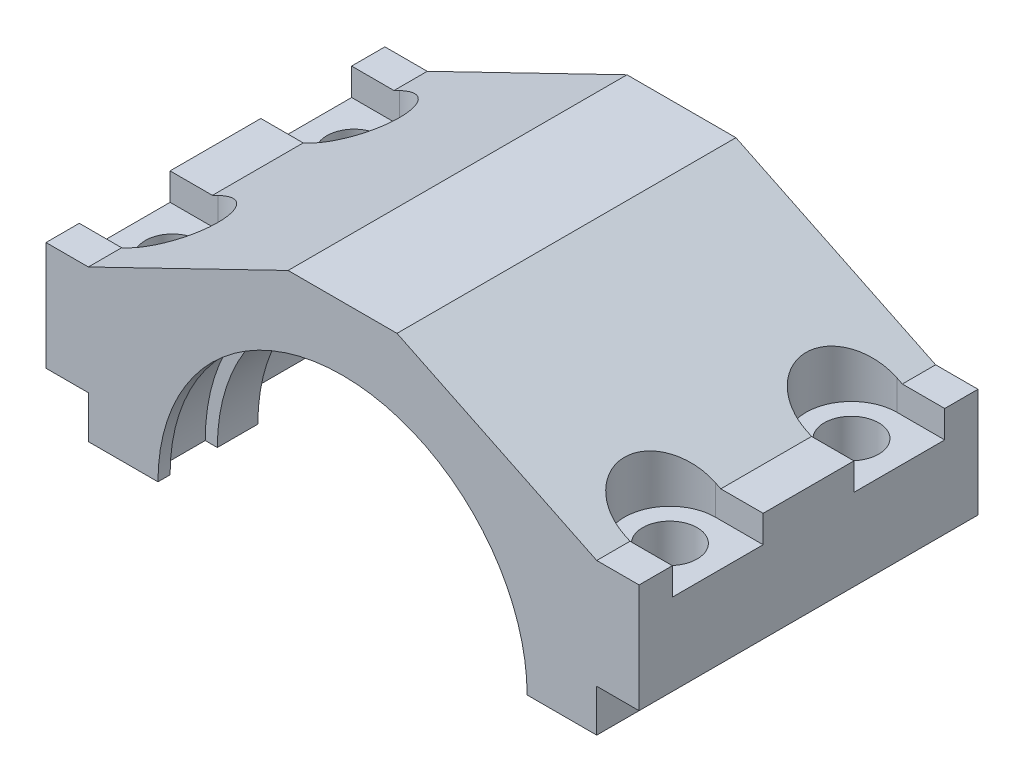
from build123d import *

# Parameters (mm, degrees)
BOSS_EXTRUDE1_DEPTH     = 28
CUT_EXTRUDE1_DEPTH      = 85.958813551
CUT_EXTRUDE2_DEPTH      = 70.756720106
CUT_EXTRUDE2_DEPTH_BACK = 4.5
CUT_EXTRUDE2_START      = 25
CUT_EXTRUDE3_START      = 25
SKETCH4_4_R             = 4.5
CUT_EXTRUDE3_DEPTH      = 95.756720106


with BuildPart() as part:
    # Sketch1 → Boss-Extrude1 (new, symmetric)
    with BuildSketch(Plane.XY):
        Polygon((-42, 0), (42, 0), (42, 7), (49, 7), (49, 25), (42, 25), (9, 41), (-9, 41), (-42, 25), (-49, 25), (-49, 7), (-42, 7), align=None)
    extrude(amount=BOSS_EXTRUDE1_DEPTH, both=True)

    # Sketch2 → Cut-Extrude1 (cut, through all)
    with BuildSketch(Plane.XY.offset(28)):
        with BuildLine():
            Line((-30.5, 0), (30.5, 0))
            ThreePointArc((30.5, 0), (0, 30.5), (-30.5, 0))
        make_face()
    extrude(amount=-CUT_EXTRUDE1_DEPTH, mode=Mode.SUBTRACT)

    # Sketch3 → Cut-Revolve1 (revolve, cut)
    with BuildSketch(Plane(origin=(0, 0, 0), x_dir=(0, 0, -1), z_dir=(1, 0, 0))):
        Polygon((28, 30.5), (26, 30.5), (26, 32.5), (17, 32.5), (17, 29.816601461), (11.5, 29.816601461), (11.5, 36), (-11.5, 36), (-11.5, 29.816601461), (-18.19, 29.816601461), (-18.19, 32.5), (-26, 32.5), (-26, 30.5), (-28, 30.5), (-28, 0), (28, 0), align=None)
    revolve(axis=Axis((0, 0, 28), (0, 0, -1)), mode=Mode.SUBTRACT)

    # Sketch4 → Cut-Extrude2 (cut, two sides: drawn at the far end of the back side and taken through both)
    with BuildSketch(Plane(origin=(0, 0, 0), x_dir=(1, 0, 0), z_dir=(0, 1, 0)).offset(CUT_EXTRUDE2_START - CUT_EXTRUDE2_DEPTH_BACK)):
        with BuildLine():
            Line((49, 22.5), (41.09, 22.5))
            ThreePointArc((41.09, 22.5), (33.59, 15), (41.09, 7.5))
            Line((41.09, 7.5), (49, 7.5))
            Line((49, 7.5), (49, 22.5))
        make_face()
        with BuildLine():
            Line((49, -7.5), (49, -22.5))
            Line((49, -22.5), (41.09, -22.5))
            ThreePointArc((41.09, -22.5), (33.59, -15), (41.09, -7.5))
            Line((41.09, -7.5), (49, -7.5))
        make_face()
        with BuildLine():
            Line((-49, -22.5), (-41.09, -22.5))
            ThreePointArc((-41.09, -22.5), (-33.59, -15), (-41.09, -7.5))
            Line((-41.09, -7.5), (-49, -7.5))
            Line((-49, -7.5), (-49, -22.5))
        make_face()
        with BuildLine():
            Line((-49, 7.5), (-49, 22.5))
            Line((-49, 22.5), (-41.09, 22.5))
            ThreePointArc((-41.09, 22.5), (-33.59, 15), (-41.09, 7.5))
            Line((-41.09, 7.5), (-49, 7.5))
        make_face()
    extrude(amount=CUT_EXTRUDE2_DEPTH + CUT_EXTRUDE2_DEPTH_BACK, mode=Mode.SUBTRACT)

    # Sketch4<4> → Cut-Extrude3 (cut, through all)
    with BuildSketch(Plane(origin=(0, 0, 0), x_dir=(1, 0, 0), z_dir=(0, 1, 0)).offset(CUT_EXTRUDE3_START)):
        with Locations((41.09, 15)):
            Circle(SKETCH4_4_R)
        with Locations((41.09, -15)):
            Circle(SKETCH4_4_R)
        with Locations((-41.09, -15)):
            Circle(SKETCH4_4_R)
        with Locations((-41.09, 15)):
            Circle(SKETCH4_4_R)
    extrude(amount=-CUT_EXTRUDE3_DEPTH, mode=Mode.SUBTRACT)


solid = part.part
